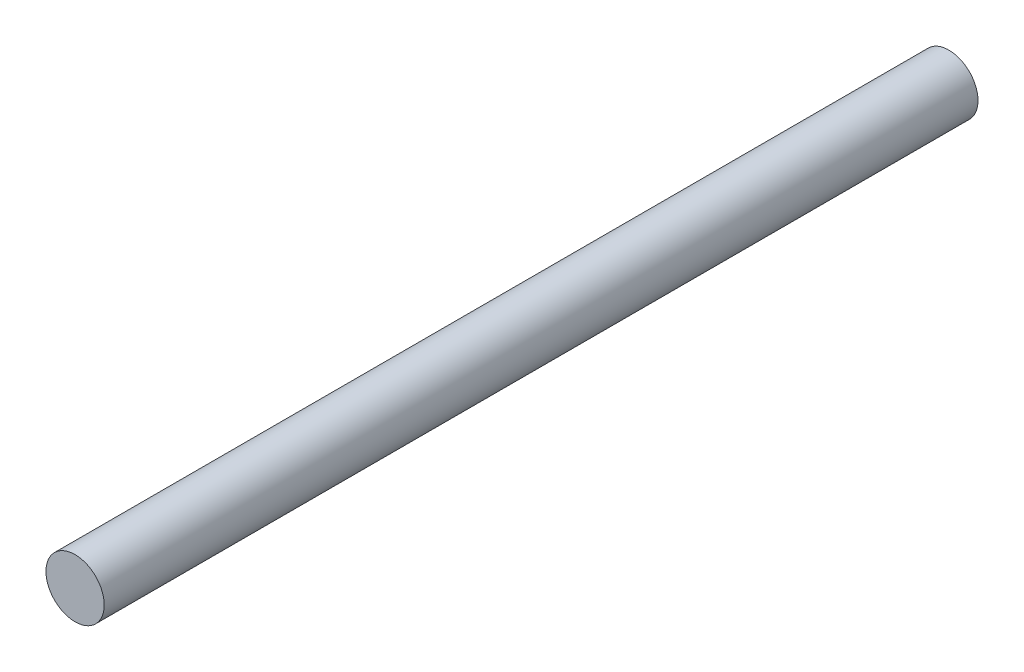
from build123d import *

# Parameters (mm, degrees)
SKETCH1_R           = 25.4
BOSS_EXTRUDE1_DEPTH = 762


with BuildPart() as part:
    # Sketch1 → Boss-Extrude1 (new body)
    with BuildSketch(Plane.XY):
        Circle(SKETCH1_R)
    extrude(amount=BOSS_EXTRUDE1_DEPTH)


solid = part.part
